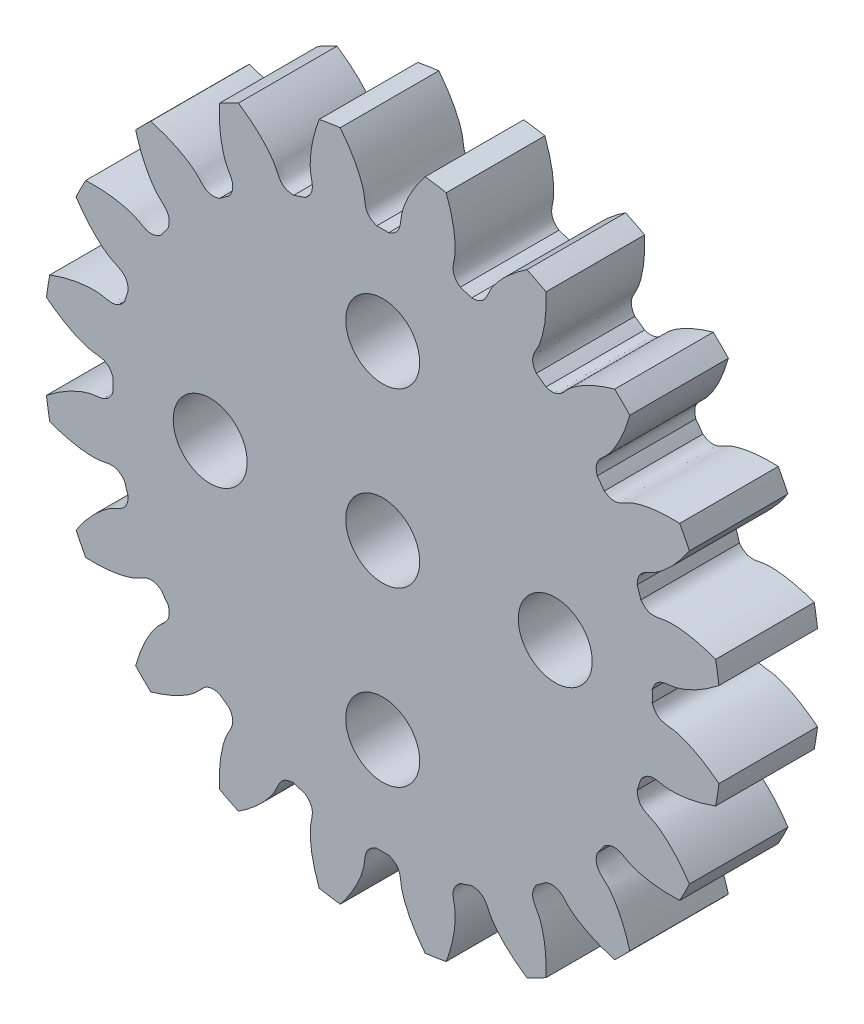
from build123d import *

# Parameters (mm, degrees)
SKETCH_1_R               = 13.75
EXTRUDE_1_DEPTH          = 4
CUT_EXTRUDE_1_DEPTH      = 20.852581696
PATTERN_CIRCULAR_1_COUNT = 20
SKETCH_4_R               = 1.5
CUT_EXTRUDE_2_DEPTH      = 10


with BuildPart() as part:
    # 草图1 → 凸台-拉伸1 (new body)
    with BuildSketch(Plane.XY):
        Circle(SKETCH_1_R)
    extrude(amount=EXTRUDE_1_DEPTH)

    # 草图2 → 切除-拉伸1 (cut, through all)
    with BuildSketch(Plane.XY):
        with BuildLine():
            ThreePointArc((0.241645751, 10.934830295), (0, 10.9375), (-0.241645751, 10.934830295))
            add(Edge.make_bspline(
                [(-0.241645751, 10.934830295), (-0.763986756, 11.11684439), (-0.696355124, 11.483892124), (-0.766121321, 11.837511753), (-0.773615233, 11.871945767), (-0.782888612, 11.910793269), (-0.794115121, 11.953996045), (-0.807473925, 12.001489371), (-0.823140069, 12.053203535), (-0.841287339, 12.109063416), (-0.862087187, 12.168988684), (-0.885708875, 12.232893806), (-0.912319248, 12.300688126), (-0.942082628, 12.372275913), (-0.975160664, 12.447556439), (-1.011712206, 12.526424039), (-1.051893167, 12.608768189), (-1.095856396, 12.694473577), (-1.143751548, 12.783420187), (-1.195724957, 12.87548338), (-1.251919512, 12.970533976), (-1.312474533, 13.068438347), (-1.377525652, 13.169058507), (-1.447204695, 13.272252205), (-1.521639564, 13.377873025), (-1.600954126, 13.485770488), (-1.685268101, 13.595790151), (-1.774696952, 13.707773716), (-1.869351783, 13.821559139), (-1.969339231, 13.936980743), (-2.074761371, 14.053869328), (-2.185715611, 14.172052294), (-2.302294605, 14.291353753), (-2.424586158, 14.411594659), (-2.552673133, 14.532592924), (-2.686633373, 14.654163553), (-2.826539612, 14.776118764), (-2.972459398, 14.898268124), (-3.124455015, 15.020418683), (-3.282583418, 15.142375102), (-3.446896124, 15.2639398), (-3.676841988, 15.427049835), (-3.854915516, 15.545415751), (-3.976447477, 15.622814825)],
                knots=[0, 0, 0, 0, 0.165916003, 0.170905922, 0.176663519, 0.183188797, 0.190481754, 0.198542391, 0.207370708, 0.216966704, 0.22733038, 0.238461736, 0.250360771, 0.263027487, 0.276461881, 0.290663956, 0.30563371, 0.321371144, 0.337876258, 0.355149051, 0.373189524, 0.391997677, 0.411573509, 0.431917021, 0.453028213, 0.474907084, 0.497553636, 0.520967867, 0.545149777, 0.570099367, 0.595816637, 0.622301587, 0.649554216, 0.677574526, 0.706362514, 0.735918183, 0.766241531, 0.797332559, 0.829191267, 0.861817654, 0.895211721, 0.929373468, 1, 1, 1, 1], degree=3))
            ThreePointArc((-3.976447477, 15.622814825), (0, 16.120932901), (3.976447477, 15.622814825))
            add(Edge.make_bspline(
                [(0.241645751, 10.934830295), (0.763986756, 11.11684439), (0.696355124, 11.483892124), (0.766121321, 11.837511753), (0.773615233, 11.871945767), (0.782888612, 11.910793269), (0.794115121, 11.953996045), (0.807473925, 12.001489371), (0.823140069, 12.053203535), (0.841287339, 12.109063416), (0.862087187, 12.168988684), (0.885708875, 12.232893806), (0.912319248, 12.300688126), (0.942082628, 12.372275913), (0.975160664, 12.447556439), (1.011712206, 12.526424039), (1.051893167, 12.608768189), (1.095856396, 12.694473577), (1.143751548, 12.783420187), (1.195724957, 12.87548338), (1.251919512, 12.970533976), (1.312474533, 13.068438347), (1.377525652, 13.169058507), (1.447204695, 13.272252205), (1.521639564, 13.377873025), (1.600954126, 13.485770488), (1.685268101, 13.595790151), (1.774696952, 13.707773716), (1.869351783, 13.821559139), (1.969339231, 13.936980743), (2.074761371, 14.053869328), (2.185715611, 14.172052294), (2.302294605, 14.291353753), (2.424586158, 14.411594659), (2.552673133, 14.532592924), (2.686633373, 14.654163553), (2.826539612, 14.776118764), (2.972459398, 14.898268124), (3.124455015, 15.020418683), (3.282583418, 15.142375102), (3.446896124, 15.2639398), (3.676841988, 15.427049835), (3.854915516, 15.545415751), (3.976447477, 15.622814825)],
                knots=[0, 0, 0, 0, 0.165916003, 0.170905922, 0.176663519, 0.183188797, 0.190481754, 0.198542391, 0.207370708, 0.216966704, 0.22733038, 0.238461736, 0.250360771, 0.263027487, 0.276461881, 0.290663956, 0.30563371, 0.321371144, 0.337876258, 0.355149051, 0.373189524, 0.391997677, 0.411573509, 0.431917021, 0.453028213, 0.474907084, 0.497553636, 0.520967867, 0.545149777, 0.570099367, 0.595816637, 0.622301587, 0.649554216, 0.677574526, 0.706362514, 0.735918183, 0.766241531, 0.797332559, 0.829191267, 0.861817654, 0.895211721, 0.929373468, 1, 1, 1, 1], degree=3))
        make_face()
    cut_extrude_1 = extrude(amount=CUT_EXTRUDE_1_DEPTH, mode=Mode.SUBTRACT)

    # 阵列(圆周)1: 切除-拉伸1 ×20 about axis
    pattern_circular_1_axis = Axis((0, 0, -1.5), (0, 0, 1))
    for i in range(1, PATTERN_CIRCULAR_1_COUNT):
        add(cut_extrude_1.rotate(pattern_circular_1_axis, i * 360 / PATTERN_CIRCULAR_1_COUNT), mode=Mode.SUBTRACT)

    # 草图4 → 切除-拉伸2 (cut)
    with BuildSketch(Plane.XY.offset(4)):
        Circle(SKETCH_4_R)
        with Locations((0, 7)):
            Circle(SKETCH_4_R)
        with Locations((7, 0)):
            Circle(SKETCH_4_R)
        with Locations((-7, 0)):
            Circle(SKETCH_4_R)
        with Locations((0, -7)):
            Circle(SKETCH_4_R)
    extrude(amount=-CUT_EXTRUDE_2_DEPTH, mode=Mode.SUBTRACT)


solid = part.part
